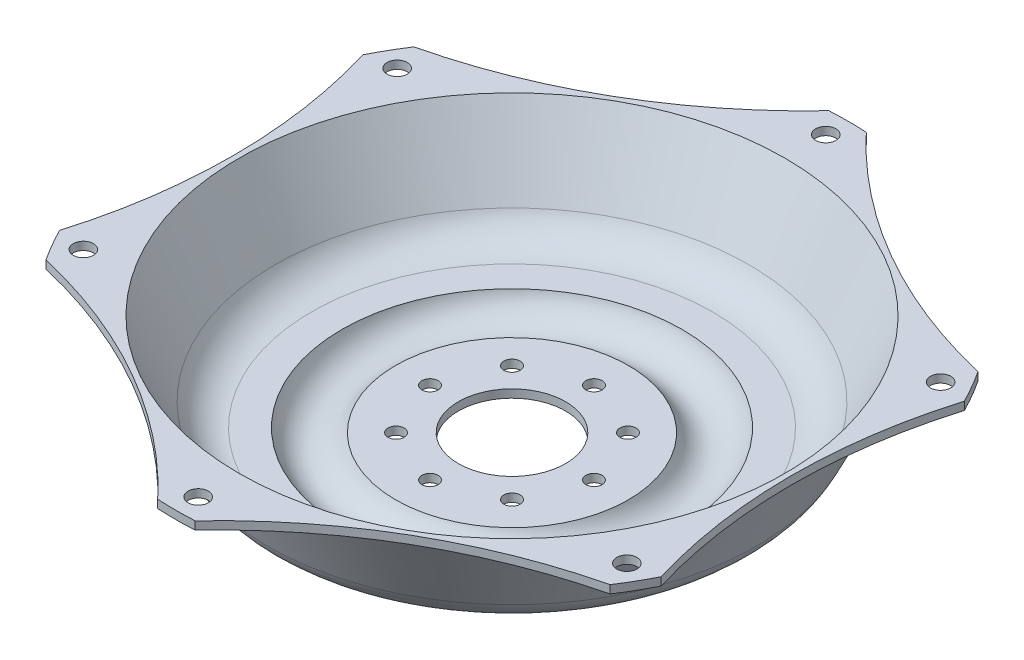
from build123d import *

# Parameters (mm, degrees)
THICKEN1_T1            = 8
CUT_EXTRUDE1_DEPTH     = 485.367654355
CIRPATTERN1_COUNT      = 6
F_16_0MM_DOWEL_HOLE2_D = 16
CIRPATTERN2_COUNT      = 8


with BuildPart() as body_1:
    # Surface-Revolve1: a surface, the sketch's curves turned about an axis
    with BuildLine(Plane.XY, mode=Mode.PRIVATE) as surface_revolve1_1_path:
        Line((53, 0), (115, 0))
        ThreePointArc((115, 0), (143.012028142, -16.093774461), (168.057295138, 4.312545592))
        Line((168.057295138, 4.312545592), (198.057295138, 4.312545592))
        ThreePointArc((198.057295138, 4.312545592), (219.254065707, 10.390621746), (234.00905699, 26.77769972))
        Line((234.00905699, 26.77769972), (269.721959046, 100))
        Line((269.721959046, 100), (332.5, 100))
    surface_revolve1_1 = Shell.revolve(surface_revolve1_1_path.wire(), 360, Axis((0, 0, 0), (0, 1, 0)))
    add(Solid.thicken(surface_revolve1_1, THICKEN1_T1))

    # Sketch2 → Cut-Extrude1 (cut, through all)
    with BuildSketch(Plane.XZ.offset(-92)):
        with BuildLine():
            ThreePointArc((-278.018608961, 182.378461095), (-137.025263873, 238.108499582), (-18, 332.012424466))
            ThreePointArc((-18, 332.012424466), (-165.844309403, 288.187291598), (-278.018608961, 182.378461095))
        make_face()
        with BuildLine():
            ThreePointArc((0, 320), (-10, 310), (0, 300))
            Line((0, 300), (0, 320))
        make_face()
        with BuildLine():
            Line((0, 320), (0, 300))
            ThreePointArc((0, 300), (7.071067812, 302.928932188), (10, 310))
            ThreePointArc((10, 310), (7.071067812, 317.071067812), (0, 320))
        make_face()
    cut_extrude1 = extrude(amount=-CUT_EXTRUDE1_DEPTH, mode=Mode.SUBTRACT)

    # CirPattern1: Cut-Extrude1 ×6 about axis
    cirpattern1_axis = Axis((0, 0, 0), (0, 1, 0))
    for i in range(1, CIRPATTERN1_COUNT):
        add(cut_extrude1.rotate(cirpattern1_axis, i * 360 / CIRPATTERN1_COUNT), mode=Mode.SUBTRACT)

    # Ø16.0mm Dowel Hole2 (through all)
    with Locations(Plane(origin=(0, 0, 0), x_dir=(1, 0, 0), z_dir=(0, 1, 0))):
        with Locations((0, 81)):
            f_16_0mm_dowel_hole2 = Hole(F_16_0MM_DOWEL_HOLE2_D / 2)

    # CirPattern2: Ø16.0mm Dowel Hole2 ×8 about axis
    cirpattern2_axis = Axis((0, 0, 0), (0, 1, 0))
    for i in range(1, CIRPATTERN2_COUNT):
        add(f_16_0mm_dowel_hole2.rotate(cirpattern2_axis, i * 360 / CIRPATTERN2_COUNT), mode=Mode.SUBTRACT)


solid = body_1.part
